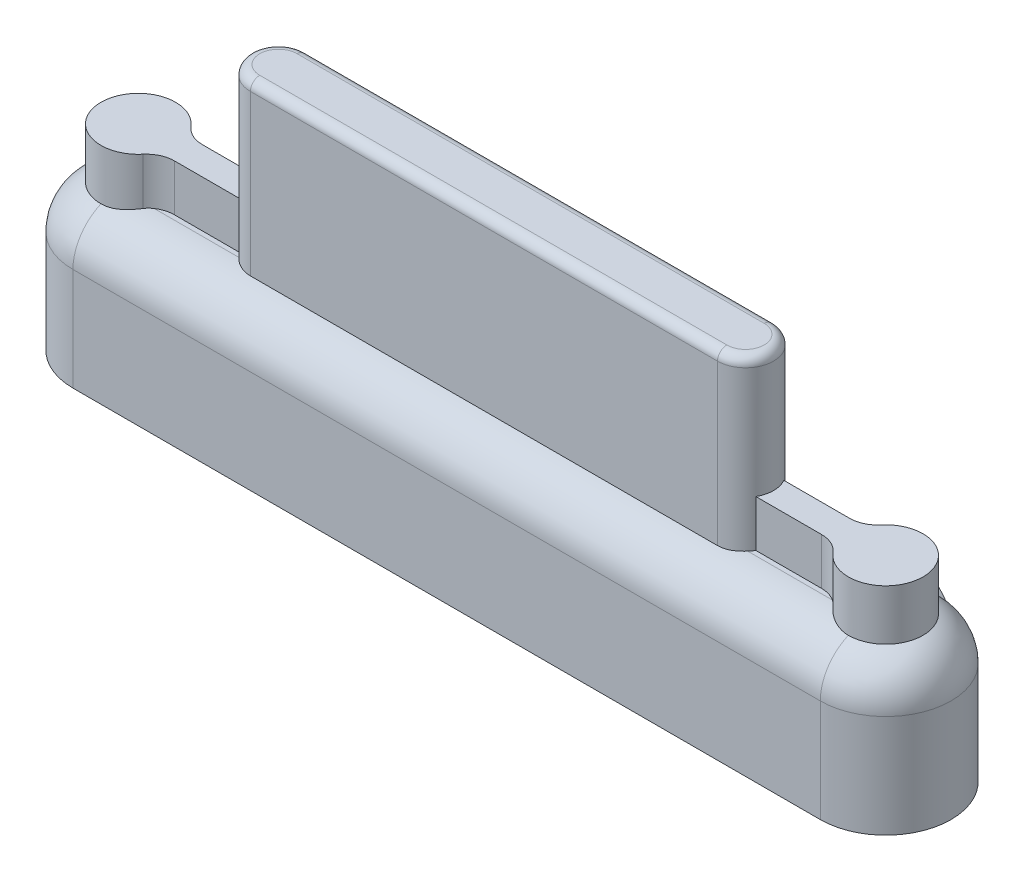
from build123d import *

# Parameters (mm, degrees)
BOSS_EXTRUDE1_DEPTH      = 8
FILLET1_R                = 2.5
BOSS_EXTRUDE2_DEPTH      = 9
BOSS_EXTRUDE2_DEPTH_BACK = 1
FILLET2_R                = 0.5
BOSS_EXTRUDE3_DEPTH      = 2.5
BOSS_EXTRUDE3_DEPTH_BACK = 1
SKETCH4_R                = 1.25
CUT_EXTRUDE1_DEPTH       = 9
CUT_EXTRUDE2_DEPTH       = 4
BOSS_EXTRUDE4_DEPTH      = 1
BOSS_EXTRUDE4_DEPTH_BACK = 1
SKETCH6_R                = 3
SKETCH7_R                = 1.25
CUT_EXTRUDE3_DEPTH       = 5


with BuildPart() as part:
    # Sketch1 → Boss-Extrude1 (new body)
    with BuildSketch(Plane(origin=(0, 0, 0), x_dir=(1, 0, 0), z_dir=(0, 1, 0))):
        with BuildLine():
            Line((-20, 3.5), (20, 3.5))
            ThreePointArc((20, 3.5), (23.5, 0), (20, -3.5))
            Line((20, -3.5), (-20, -3.5))
            ThreePointArc((-20, -3.5), (-23.5, 0), (-20, 3.5))
        make_face()
    extrude(amount=BOSS_EXTRUDE1_DEPTH)

    # Fillet1
    fillet1_edges = [part.edges().sort_by_distance(p)[0] for p in [
        (23.5, 8, 0),
        (0, 8, -3.5),
        (-23.5, 8, 0),
        (0, 8, 3.5),
    ]]
    fillet(fillet1_edges, radius=FILLET1_R)

    # Sketch2 → Boss-Extrude2 (add, two sides: drawn at the far end of the back side and taken through both)
    with BuildSketch(Plane(origin=(0, 8, 0), x_dir=(1, 0, 0), z_dir=(0, 1, 0)).offset(-BOSS_EXTRUDE2_DEPTH_BACK)):
        with BuildLine():
            Line((-12.5, 1.5), (12.5, 1.5))
            ThreePointArc((12.5, 1.5), (14, 0), (12.5, -1.5))
            Line((12.5, -1.5), (-12.5, -1.5))
            ThreePointArc((-12.5, -1.5), (-14, 0), (-12.5, 1.5))
        make_face()
    extrude(amount=BOSS_EXTRUDE2_DEPTH + BOSS_EXTRUDE2_DEPTH_BACK)

    # Fillet2
    fillet2_edges = [part.edges().sort_by_distance(p)[0] for p in [
        (-14, 17, 0),
        (0, 17, 1.5),
        (14, 17, 0),
        (0, 17, -1.5),
    ]]
    fillet(fillet2_edges, radius=FILLET2_R)

    # Sketch3 → Boss-Extrude3 (add, two sides: drawn at the far end of the back side and taken through both)
    with BuildSketch(Plane(origin=(0, 8, 0), x_dir=(1, 0, 0), z_dir=(0, 1, 0)).offset(-BOSS_EXTRUDE3_DEPTH_BACK)):
        with BuildLine():
            Line((-17.319048676, 0.75), (-13.799038106, 0.75))
            ThreePointArc((-13.799038106, 0.75), (-14, 0), (-13.799038106, -0.75))
            Line((-13.799038106, -0.75), (-17.319048676, -0.75))
            ThreePointArc((-17.319048676, -0.75), (-17.952914367, -0.890509549), (-18.468027815, -1.285714286))
            ThreePointArc((-18.468027815, -1.285714286), (-22, 0), (-18.468027815, 1.285714286))
            ThreePointArc((-18.468027815, 1.285714286), (-17.952914367, 0.890509549), (-17.319048676, 0.75))
        make_face()
        with BuildLine():
            Line((17.319048676, -0.75), (13.799038106, -0.75))
            ThreePointArc((13.799038106, -0.75), (14, 0), (13.799038106, 0.75))
            Line((13.799038106, 0.75), (17.319048676, 0.75))
            ThreePointArc((17.319048676, 0.75), (17.952914367, 0.890509549), (18.468027815, 1.285714286))
            ThreePointArc((18.468027815, 1.285714286), (22, 0), (18.468027815, -1.285714286))
            ThreePointArc((18.468027815, -1.285714286), (17.952914367, -0.890509549), (17.319048676, -0.75))
        make_face()
    extrude(amount=BOSS_EXTRUDE3_DEPTH + BOSS_EXTRUDE3_DEPTH_BACK)

    # Sketch4 → Cut-Extrude1 (cut)
    with BuildSketch(Plane.XZ):
        with Locations(Location((20, 0, 0), (0, 0, 270))):
            Circle(SKETCH4_R)
        with Locations(Location((-20, 0, 0), (0, 0, 270))):
            Circle(SKETCH4_R)
    extrude(amount=-CUT_EXTRUDE1_DEPTH, mode=Mode.SUBTRACT)

    # Sketch5 → Cut-Extrude2 (cut)
    with BuildSketch(Plane.XZ):
        with BuildLine():
            Line((8.51994599, 1.25), (-8.51994599, 1.25))
            ThreePointArc((-8.51994599, 1.25), (-11.157492475, 0.157492475), (-12.25, -2.48005401))
            Line((-12.25, -2.48005401), (-12.25, -3.5))
            Line((-12.25, -3.5), (12.25, -3.5))
            Line((12.25, -3.5), (12.25, -2.48005401))
            ThreePointArc((12.25, -2.48005401), (11.157492475, 0.157492475), (8.51994599, 1.25))
        make_face()
    extrude(amount=-CUT_EXTRUDE2_DEPTH, mode=Mode.SUBTRACT)

    # Sketch6 → Boss-Extrude4 (add, two sides: drawn at the far end of the back side and taken through both)
    with BuildSketch(Plane(origin=(0, 0, -3.5), x_dir=(-1, 0, 0), z_dir=(0, 0, -1)).offset(-BOSS_EXTRUDE4_DEPTH_BACK)):
        with Locations((-16.25, 3.79375)):
            Circle(SKETCH6_R)
        with Locations(Location((16.25, 3.79375, 0), (0, 0, 34.663105373))):
            Circle(SKETCH6_R)
    extrude(amount=BOSS_EXTRUDE4_DEPTH + BOSS_EXTRUDE4_DEPTH_BACK)

    # Sketch7 → Cut-Extrude3 (cut)
    with BuildSketch(Plane(origin=(0, 0, -4.5), x_dir=(-1, 0, 0), z_dir=(0, 0, -1))):
        with Locations((-16.25, 3.79375)):
            Circle(SKETCH7_R)
        with Locations((16.25, 3.79375)):
            Circle(SKETCH7_R)
    extrude(amount=-CUT_EXTRUDE3_DEPTH, mode=Mode.SUBTRACT)


solid = part.part
